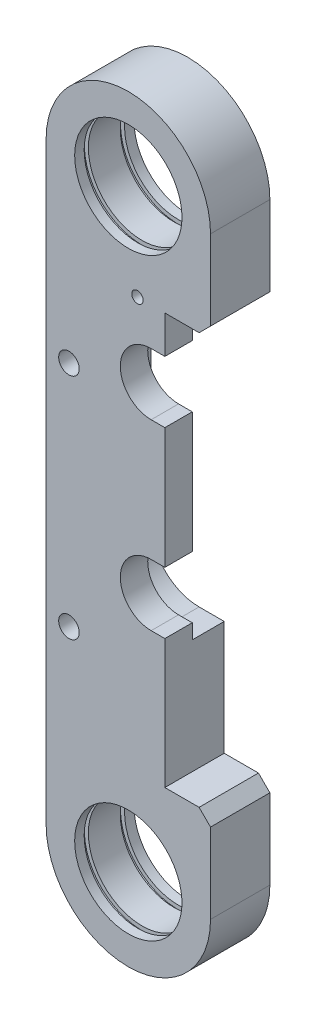
from build123d import *

# Parameters (mm, degrees)
SKIZZE1_R                       = 23.5
AUFSATZ_LINEAR_AUSTRAGEN1_DEPTH = 26
F_9_0_9_DURCHMESSER_BOHRUNG1_D  = 9
SKIZZE5_W                       = 1.85
SKIZZE5_H                       = 1.75
SCHNITT_LINEAR_AUSTRAGEN1_DEPTH = 14
M6_GEWINDEBOHRUNG1_D            = 5
M6_GEWINDEBOHRUNG1_DEPTH        = 17
M6_GEWINDEBOHRUNG1_TIP          = 1.502151548
SCHNITT_LINEAR_AUSTRAGEN2_DEPTH = 171.434738243
M6_GEWINDEBOHRUNG2_D            = 5


with BuildPart() as part:
    # Skizze1 → Aufsatz-Linear austragen1 (new body)
    with BuildSketch(Plane.XY):
        with BuildLine():
            Line((31, 90), (16, 90))
            Line((16, 90), (16, -90))
            Line((16, -90), (31, -90))
            Line((31, -90), (36, -95))
            Line((36, -95), (36, -130))
            ThreePointArc((36, -130), (0, -166), (-36, -130))
            Line((-36, -130), (-36, 130))
            ThreePointArc((-36, 130), (0, 166), (36, 130))
            Line((36, 130), (36, 95))
            Line((36, 95), (31, 90))
        make_face()
        with Locations(Location((0, -130, 0), (0, 0, 180))):
            Circle(SKIZZE1_R, mode=Mode.SUBTRACT)
        with Locations(Location((0, 130, 0), (0, 0, 180))):
            Circle(SKIZZE1_R, mode=Mode.SUBTRACT)
    extrude(amount=AUFSATZ_LINEAR_AUSTRAGEN1_DEPTH)

    # Ø9.0 (9) Durchmesser Bohrung1 (through all)
    with Locations(Plane.XY.offset(26)):
        with Locations((-26, 50), (-26, -50)):
            Hole(F_9_0_9_DURCHMESSER_BOHRUNG1_D / 2)

    # Skizze5 → Schnitt-Rotation1 (revolve, cut)
    with BuildSketch(Plane(origin=(0, 0, 0), x_dir=(0, 0, -1), z_dir=(1, 0, 0)), mode=Mode.PRIVATE) as schnitt_rotation1_sk:
        with Locations((-20.925, 154.375)):
            Rectangle(SKIZZE5_W, SKIZZE5_H)
        with Locations((-5.075, 154.375)):
            Rectangle(SKIZZE5_W, SKIZZE5_H)
    schnitt_rotation1 = revolve(schnitt_rotation1_sk.sketch.rotate(Axis((0, 130, 39.739957874), (0, 0, -1)), 270), axis=Axis((0, 130, 39.739957874), (0, 0, -1)), mode=Mode.SUBTRACT)

    # Spiegeln1: Schnitt-Rotation1 across plane
    add(schnitt_rotation1.mirror(Plane.ZX), mode=Mode.SUBTRACT)

    # Skizze6 → Schnitt-Linear austragen1 (cut)
    with BuildSketch(Plane(origin=(0, 0, 0), x_dir=(-1, 0, 0), z_dir=(0, 0, -1))):
        with BuildLine():
            Line((-16, -40), (-16, 80))
            Line((-16, 80), (-5, 80))
            ThreePointArc((-5, 80), (9.849242405, 73.849242405), (16, 59))
            Line((16, 59), (16, -19))
            ThreePointArc((16, -19), (9.849242405, -33.849242405), (-5, -40))
            Line((-5, -40), (-16, -40))
        make_face()
    extrude(amount=-SCHNITT_LINEAR_AUSTRAGEN1_DEPTH, mode=Mode.SUBTRACT)

    # M6 Gewindebohrung1
    with Locations(Plane.ZY.offset(36)):
        with Locations((11.4, 63), (11.4, -82)):
            Hole(M6_GEWINDEBOHRUNG1_D / 2, depth=M6_GEWINDEBOHRUNG1_DEPTH)
            with Locations((0, 0, -(M6_GEWINDEBOHRUNG1_DEPTH + M6_GEWINDEBOHRUNG1_TIP / 2))):  # 118° drill point
                Cone(0, M6_GEWINDEBOHRUNG1_D / 2, M6_GEWINDEBOHRUNG1_TIP, mode=Mode.SUBTRACT)

    # Skizze9 → Schnitt-Linear austragen2 (cut, through all)
    with BuildSketch(Plane(origin=(0, 0, 14), x_dir=(-1, 0, 0), z_dir=(0, 0, -1))):
        with BuildLine():
            Line((-10, 73.5), (-16, 73.5))
            Line((-16, 73.5), (-16, 46.5))
            Line((-16, 46.5), (-10, 46.5))
            ThreePointArc((-10, 46.5), (3.5, 60), (-10, 73.5))
        make_face()
        with BuildLine():
            Line((-10, -6.5), (-16, -6.5))
            Line((-16, -6.5), (-16, -33.5))
            Line((-16, -33.5), (-10, -33.5))
            ThreePointArc((-10, -33.5), (3.5, -20), (-10, -6.5))
        make_face()
    extrude(amount=-SCHNITT_LINEAR_AUSTRAGEN2_DEPTH, mode=Mode.SUBTRACT)

    # M6 Gewindebohrung2 (through all)
    with Locations(Plane.XY.offset(26)):
        with Locations((4, 90)):
            Hole(M6_GEWINDEBOHRUNG2_D / 2)


solid = part.part
